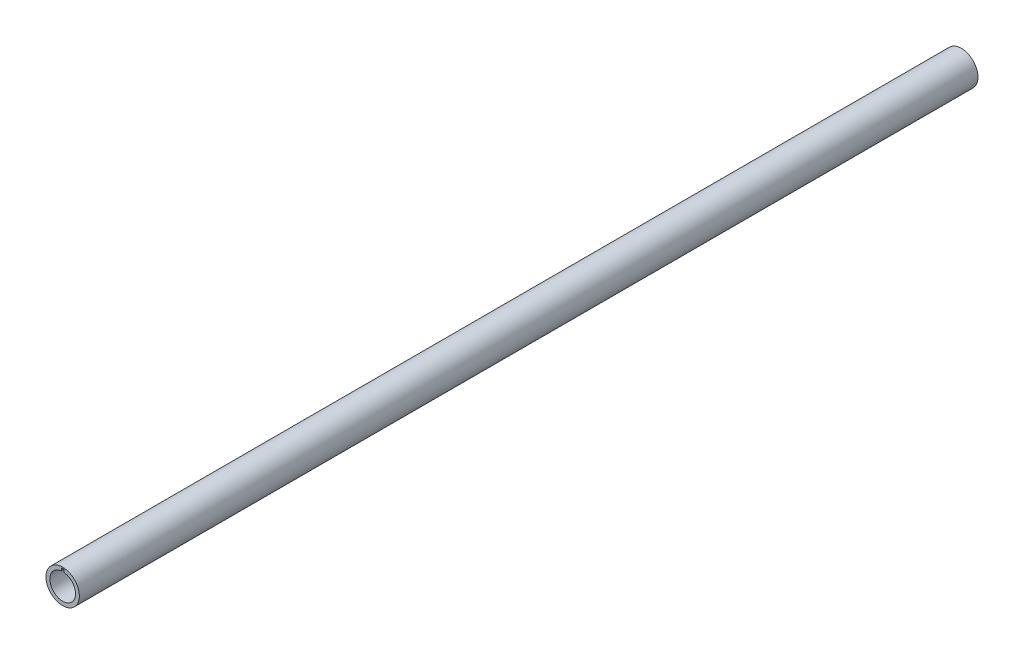
from build123d import *

# Parameters (mm, degrees)
SKETCH1_R           = 13
SKETCH1_R_2         = 10
BOSS_EXTRUDE1_DEPTH = 700
CUT_EXTRUDE1_START  = -20
CUT_EXTRUDE1_DEPTH  = 20
CUT_EXTRUDE2_DEPTH  = 20


with BuildPart() as part:
    # Sketch1 → Boss-Extrude1 (new body)
    with BuildSketch(Plane.XY):
        Circle(SKETCH1_R)
        Circle(SKETCH1_R_2, mode=Mode.SUBTRACT)
    extrude(amount=BOSS_EXTRUDE1_DEPTH)

    # Sketch2 → Cut-Extrude1 (cut)
    with BuildSketch(Plane.XY.offset(700).offset(CUT_EXTRUDE1_START)):
        with BuildLine():
            Line((-1, 9.949874371), (-1, 12))
            Line((-1, 12), (1, 12))
            Line((1, 12), (1, 9.949874371))
            ThreePointArc((1, 9.949874371), (0, 10), (-1, 9.949874371))
        make_face()
    extrude(amount=CUT_EXTRUDE1_DEPTH, mode=Mode.SUBTRACT)

    # Sketch3 → Cut-Extrude2 (cut)
    with BuildSketch(Plane(origin=(0, 0, 0), x_dir=(-1, 0, 0), z_dir=(0, 0, -1))):
        with BuildLine():
            Line((-1, 9.949874371), (-1, 11.949874371))
            Line((-1, 11.949874371), (1, 11.949874371))
            Line((1, 11.949874371), (1, 9.949874371))
            ThreePointArc((1, 9.949874371), (0, 10), (-1, 9.949874371))
        make_face()
    extrude(amount=-CUT_EXTRUDE2_DEPTH, mode=Mode.SUBTRACT)


solid = part.part
